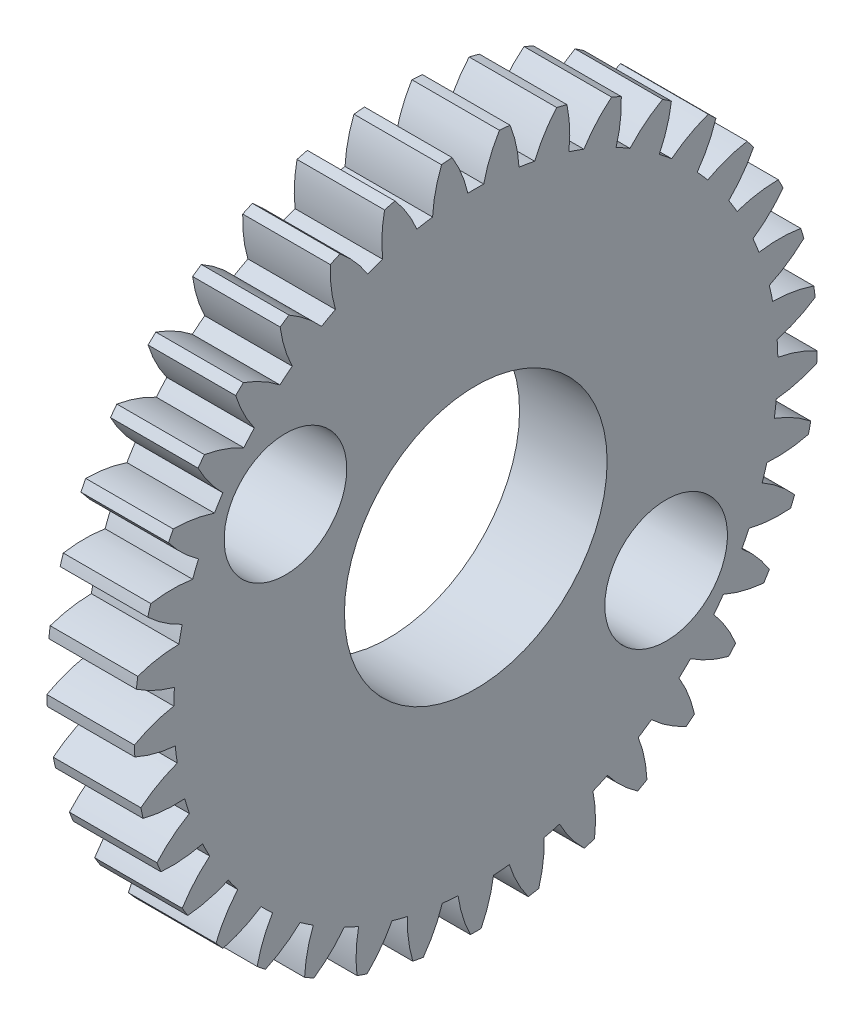
from build123d import *

# Parameters (mm, degrees)
BASPROSKE_W                  = 3
BASPROSKE_H                  = 11.7
TOOTHCUT_DEPTH               = 17.816063749
TEETHCUTS_COUNT              = 37
TEETHCUTS_ANGLE              = 350.27027027
BORSKE_R                     = 4.5
BORE_DEPTH                   = 50.0000508
ESQUISSE1_R                  = 2.1
ENL_V_MAT_EXTRU_1_DEPTH      = 17.81312549
R_P_TITION_CIRCULAIRE1_COUNT = 2


with BuildPart() as part:
    # BasProSke → Base-Revolve (revolve)
    with BuildSketch(Plane(origin=(0, 0, 0), x_dir=(1, 0, 0), z_dir=(0, 1, 0)), mode=Mode.PRIVATE) as base_revolve_sk:
        with Locations((1.5, 5.85)):
            Rectangle(BASPROSKE_W, BASPROSKE_H)
    revolve(base_revolve_sk.sketch.rotate(Axis((-10, 0, 0), (1, 0, 0)), 180), axis=Axis((-10, 0, 0), (1, 0, 0)))

    # TooCutSke → ToothCut (cut, through all)
    with BuildSketch(Plane(origin=(0, 0, 0), x_dir=(0, 0, -1), z_dir=(1, 0, 0))):
        with BuildLine():
            ThreePointArc((0.272068338, 10.345423134), (0, 10.349), (-0.272068338, 10.345423134))
            ThreePointArc((-0.272068338, 10.345423134), (-0.492850638, 11.043764952), (-0.825433294, 11.69630989))
            ThreePointArc((-0.825433294, 11.69630989), (0, 11.7254), (0.825433294, 11.69630989))
            ThreePointArc((0.825433294, 11.69630989), (0.492850638, 11.043764952), (0.272068338, 10.345423134))
        make_face()
    toothcut = extrude(amount=TOOTHCUT_DEPTH, mode=Mode.SUBTRACT)

    # TeethCuts: ToothCut ×37 about axis
    teethcuts_axis = Axis((-10, 0, 0), (1, 0, 0))
    for i in range(1, TEETHCUTS_COUNT):
        add(toothcut.rotate(teethcuts_axis, i * TEETHCUTS_ANGLE / (TEETHCUTS_COUNT - 1)), mode=Mode.SUBTRACT)

    # BorSke → Bore (cut, symmetric)
    with BuildSketch(Plane(origin=(0, 0, 0), x_dir=(0, 0, -1), z_dir=(1, 0, 0))):
        with Locations(Location((0, 0, 0), (0, 0, 180))):
            Circle(BORSKE_R)
    extrude(amount=BORE_DEPTH, both=True, mode=Mode.SUBTRACT)

    # Esquisse1 → Enlèv. mat.-Extru.1 (cut, through all)
    with BuildSketch(Plane(origin=(3, 0, 0), x_dir=(0, 0, -1), z_dir=(1, 0, 0))):
        with Locations((-6.521162022, 4.242976064)):
            Circle(ESQUISSE1_R)
    enl_v_mat_extru_1 = extrude(amount=-ENL_V_MAT_EXTRU_1_DEPTH, mode=Mode.SUBTRACT)

    # Répétition circulaire1: Enlèv. mat.-Extru.1 ×2 about axis
    r_p_tition_circulaire1_axis = Axis((0, 0, 0), (1, 0, 0))
    for i in range(1, R_P_TITION_CIRCULAIRE1_COUNT):
        add(enl_v_mat_extru_1.rotate(r_p_tition_circulaire1_axis, i * 360 / R_P_TITION_CIRCULAIRE1_COUNT), mode=Mode.SUBTRACT)


solid = part.part
